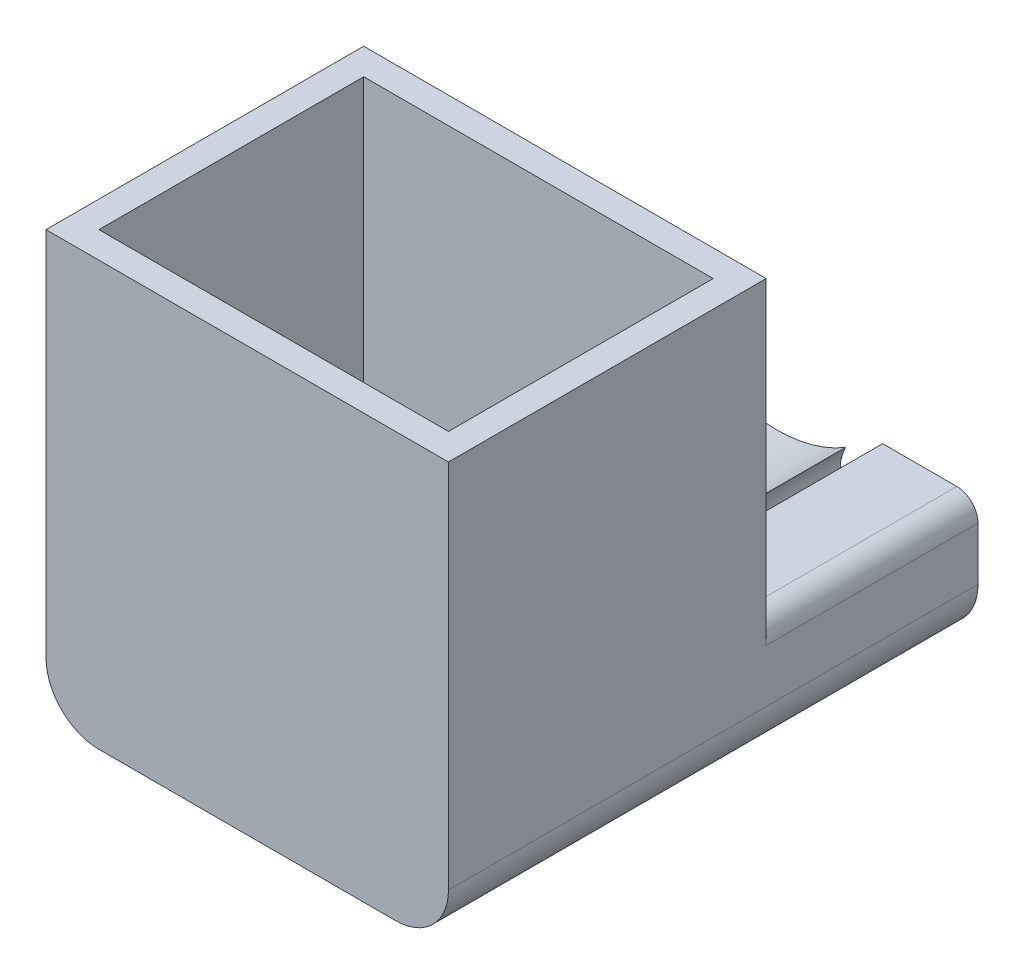
from build123d import *

# Parameters (mm, degrees)
BOSS_EXTRUDE1_DEPTH = 10
SKETCH2_W           = 38
SKETCH2_H           = 40
BOSS_EXTRUDE2_DEPTH = 30
FILLET1_R           = 5
FILLET2_R           = 2
SKETCH4_W           = 33
SKETCH4_H           = 25
CUT_EXTRUDE1_DEPTH  = 35


with BuildPart() as part:
    # Sketch1 → Boss-Extrude1 (new, symmetric)
    with BuildSketch(Plane.XY):
        with BuildLine():
            Line((-10, -9.124404748), (-19, -9.124404748))
            Line((-19, -9.124404748), (-19, -21.124404748))
            Line((-19, -21.124404748), (19, -21.124404748))
            Line((19, -21.124404748), (19, -9.124404748))
            Line((19, -9.124404748), (10, -9.124404748))
            ThreePointArc((10, -9.124404748), (12.023420987, -16.574878268), (6.509119733, -11.171520993))
            ThreePointArc((6.509119733, -11.171520993), (0, -13), (-6.509119733, -11.171520993))
            ThreePointArc((-6.509119733, -11.171520993), (-12.023420987, -16.574878268), (-10, -9.124404748))
        make_face()
    extrude(amount=BOSS_EXTRUDE1_DEPTH, both=True)

    # Sketch2 → Boss-Extrude2 (add)
    with BuildSketch(Plane.XY.offset(10)):
        with Locations((0, -1.124404748)):
            Rectangle(SKETCH2_W, SKETCH2_H)
    extrude(amount=BOSS_EXTRUDE2_DEPTH)

    # Fillet1
    fillet1_edges = [part.edges().sort_by_distance(p)[0] for p in [
        (19, -21.124404748, 15),
        (-19, -21.124404748, 15),
    ]]
    fillet(fillet1_edges, radius=FILLET1_R)

    # Fillet2
    fillet2_edges = [part.edges().sort_by_distance(p)[0] for p in [
        (19, -9.124404748, 0),
        (-19, -9.124404748, 0),
    ]]
    fillet(fillet2_edges, radius=FILLET2_R)

    # Sketch4 → Cut-Extrude1 (cut)
    with BuildSketch(Plane(origin=(0, 18.875595252, 0), x_dir=(1, 0, 0), z_dir=(0, 1, 0))):
        with Locations((0, -25)):
            Rectangle(SKETCH4_W, SKETCH4_H)
    extrude(amount=-CUT_EXTRUDE1_DEPTH, mode=Mode.SUBTRACT)


solid = part.part
